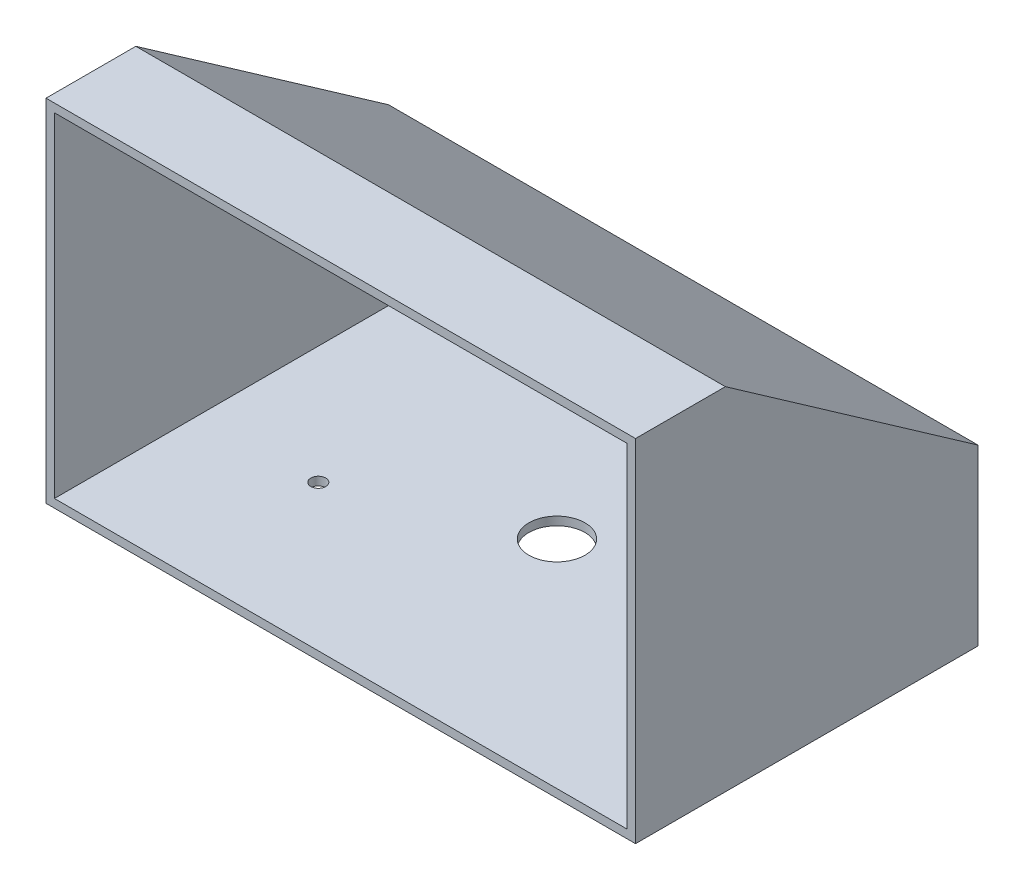
from build123d import *

# Parameters (mm, degrees)
EX_BODY_DEPTH        = 210
SHELL_T              = -3
SK_FLOORHOLES_R      = 2.65
SK_FLOORHOLES_R_2    = 10
CUT_FLOORHOLES_DEPTH = 3


with BuildPart() as part:
    # SK_Body → EX_Body (new body)
    with BuildSketch(Plane(origin=(-105, 0, 0), x_dir=(0, 0, -1), z_dir=(1, 0, 0))):
        Polygon((70, 0), (-52, 0), (-52, 125), (-20, 125), (70, 61.981321561), align=None)
    extrude(amount=EX_BODY_DEPTH)

    # Shell
    shell_openings = [part.faces().sort_by_distance(p)[0] for p in [
        (0, 62.5, 52),
    ]]
    offset(amount=SHELL_T, openings=shell_openings, kind=Kind.INTERSECTION)

    # SK_FloorHoles → CUT_FloorHoles (cut)
    with BuildSketch(Plane(origin=(0, 0, 0), x_dir=(1, 0, 0), z_dir=(0, 1, 0))):
        with Locations((60, 0)):
            Circle(SK_FLOORHOLES_R)
        with Locations((-60, 0)):
            Circle(SK_FLOORHOLES_R)
        with Locations((0, 25)):
            Circle(SK_FLOORHOLES_R_2)
    extrude(amount=CUT_FLOORHOLES_DEPTH, mode=Mode.SUBTRACT)


solid = part.part
